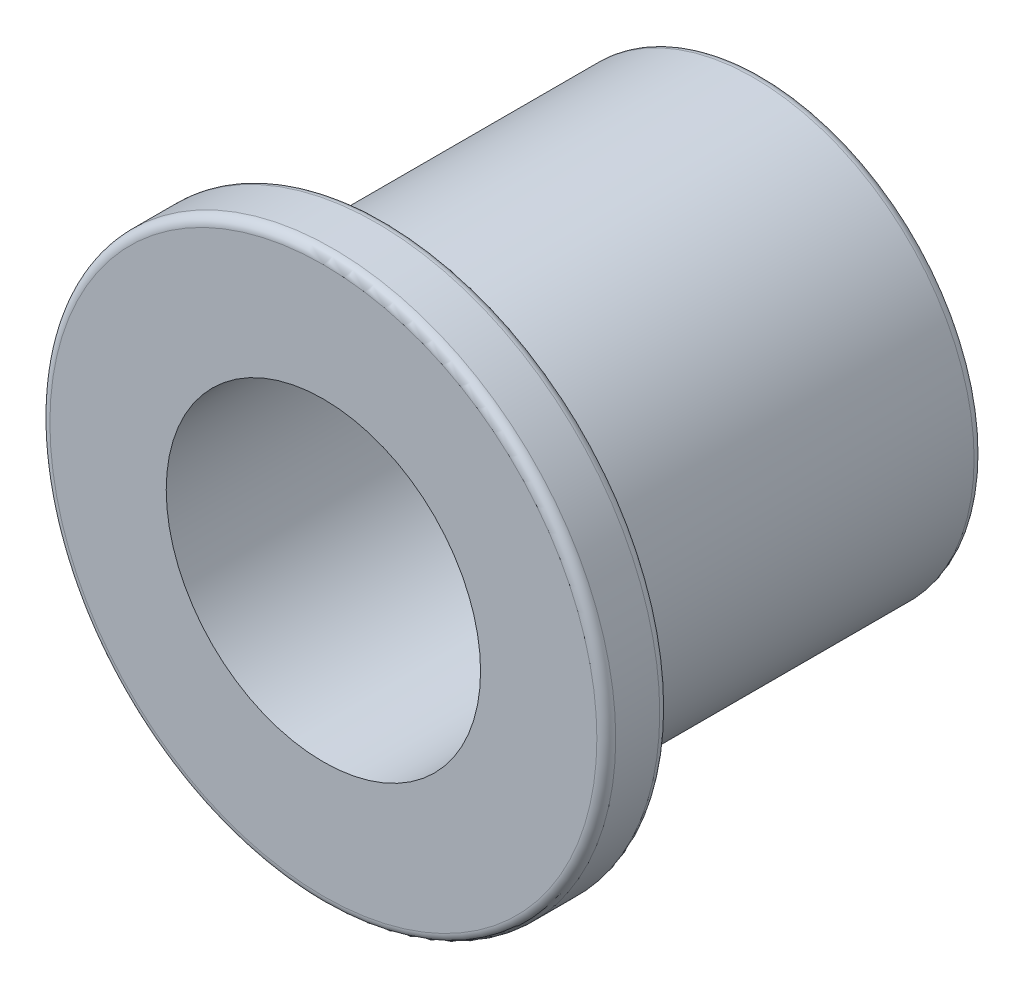
from build123d import *

# Parameters (mm, degrees)
SKETCH1_R           = 7
SKETCH1_R_2         = 5
BOSS_EXTRUDE1_DEPTH = 12
SKETCH2_R           = 9
SKETCH2_R_2         = 7
SKETCH2_R_3         = 5
BOSS_EXTRUDE2_DEPTH = 2
FILLET1_R           = 0.3


with BuildPart() as part:
    # Sketch1 → Boss-Extrude1 (new body)
    with BuildSketch(Plane.XY):
        Circle(SKETCH1_R)
        Circle(SKETCH1_R_2, mode=Mode.SUBTRACT)
    extrude(amount=BOSS_EXTRUDE1_DEPTH)

    # Sketch2 → Boss-Extrude2 (add)
    # profile 1 of 2: a face of its own
    with BuildSketch(Plane.XY.offset(12)):
        Circle(SKETCH2_R)
        Circle(SKETCH2_R_2, mode=Mode.SUBTRACT)
    # profile 2 of 2: a face of its own
    with BuildSketch(Plane.XY.offset(12)):
        Circle(SKETCH2_R_2)
        Circle(SKETCH2_R_3, mode=Mode.SUBTRACT)
    extrude(amount=BOSS_EXTRUDE2_DEPTH)

    # Fillet1
    fillet1_edges = [part.edges().sort_by_distance(p)[0] for p in [
        (-9, 0, 12),
        (-9, 0, 14),
        (-7, 0, 0),
        (-7, 0, 12),
    ]]
    fillet(fillet1_edges, radius=FILLET1_R)


solid = part.part
